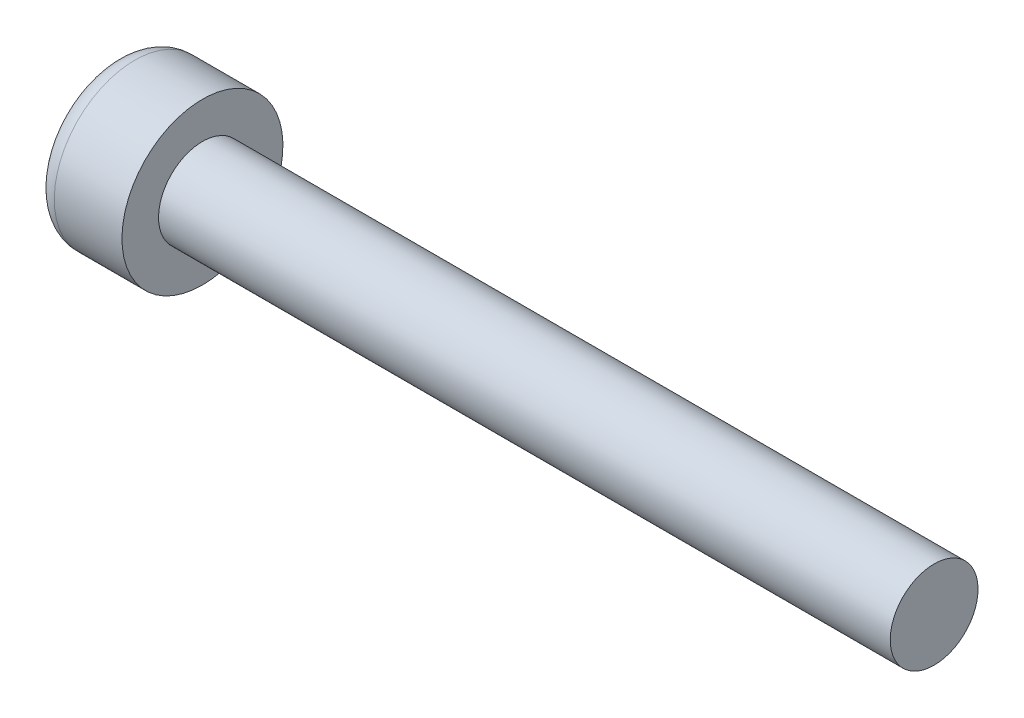
from build123d import *

# Parameters (mm, degrees)
CUT_EXTRUDE1_DEPTH = 1.5


with BuildPart() as part:
    # Sketch1 → Revolve1 (revolve)
    with BuildSketch(Plane.XY, mode=Mode.PRIVATE) as revolve1_sk:
        with BuildLine():
            Line((0, 0), (0, 2.0625))
            ThreePointArc((0, 2.0625), (0.201364088, 2.548635912), (0.6875, 2.75))
            Line((0.6875, 2.75), (3, 2.75))
            Line((3, 2.75), (3, 1.5))
            Line((3, 1.5), (28, 1.5))
            Line((28, 1.5), (28, 0))
            Line((28, 0), (0, 0))
        make_face()
    revolve(revolve1_sk.sketch.rotate(Axis((0, 0, 0), (1, 0, 0)), 180), axis=Axis((0, 0, 0), (1, 0, 0)))

    # Sketch2 → Cut-Extrude1 (cut)
    with BuildSketch(Plane.ZY):
        Polygon((0, 1.443375673), (-1.25, 0.721687836), (-1.25, -0.721687836), (0, -1.443375673), (1.25, -0.721687836), (1.25, 0.721687836), align=None)
    extrude(amount=-CUT_EXTRUDE1_DEPTH, mode=Mode.SUBTRACT)


solid = part.part
